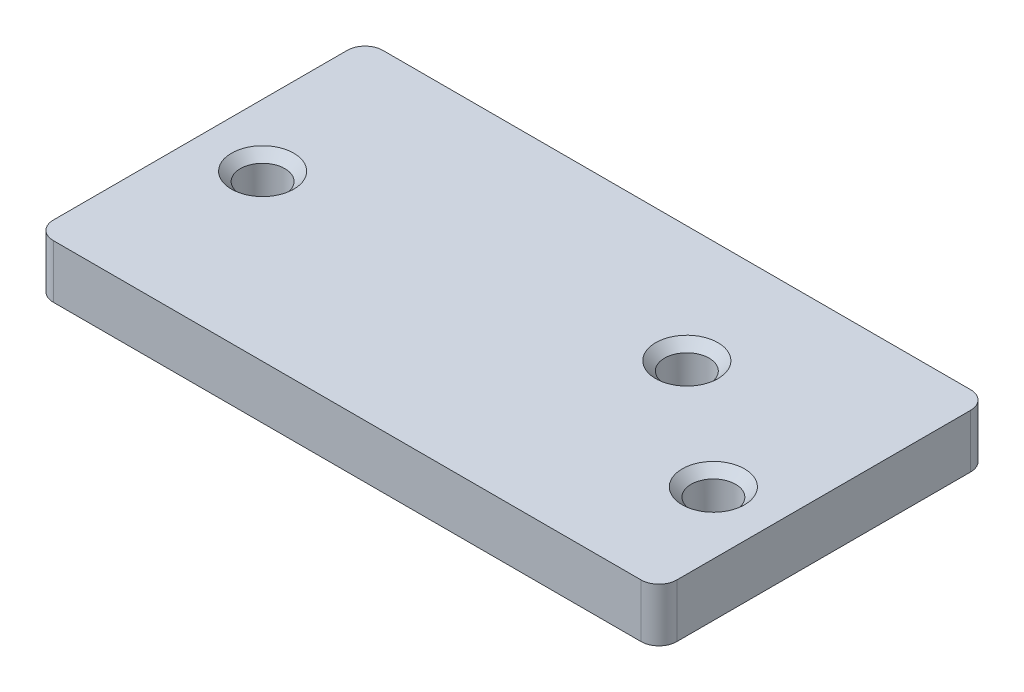
from build123d import *

# Parameters (mm, degrees)
SKETCH3_W           = 70
SKETCH3_H           = 37
BOSS_EXTRUDE1_DEPTH = 6
FILLET1_R           = 2
SKETCH4_R           = 2.5
CUT_EXTRUDE1_DEPTH  = 5
SKETCH4_3_R         = 2.5
CUT_EXTRUDE2_DEPTH  = 5
SKETCH4_5_R         = 2.5
CUT_EXTRUDE3_DEPTH  = 5
CHAMFER1_SIZE       = 1


with BuildPart() as part:
    # Sketch3 → Boss-Extrude1 (new body)
    with BuildSketch(Plane(origin=(0, 0, 0), x_dir=(1, 0, 0), z_dir=(0, 1, 0))):
        Rectangle(SKETCH3_W, SKETCH3_H)
    extrude(amount=BOSS_EXTRUDE1_DEPTH)

    # Fillet1
    fillet1_edges = [part.edges().sort_by_distance(p)[0] for p in [
        (35, 3, 18.5),
        (-35, 3, -18.5),
        (-35, 3, 18.5),
        (35, 3, -18.5),
    ]]
    fillet(fillet1_edges, radius=FILLET1_R)

    # Sketch4 → Cut-Extrude1 (cut)
    with BuildSketch(Plane(origin=(0, 6, 0), x_dir=(1, 0, 0), z_dir=(0, 1, 0))):
        with Locations((28, -5.39)):
            Circle(SKETCH4_R)
    extrude(amount=-CUT_EXTRUDE1_DEPTH, mode=Mode.SUBTRACT)

    # Sketch4<3> → Cut-Extrude2 (cut)
    with BuildSketch(Plane(origin=(0, 6, 0), x_dir=(1, 0, 0), z_dir=(0, 1, 0))):
        with Locations((14.24, 5.39)):
            Circle(SKETCH4_3_R)
    extrude(amount=-CUT_EXTRUDE2_DEPTH, mode=Mode.SUBTRACT)

    # Sketch4<5> → Cut-Extrude3 (cut)
    with BuildSketch(Plane(origin=(0, 6, 0), x_dir=(1, 0, 0), z_dir=(0, 1, 0))):
        with Locations((-28, 0)):
            Circle(SKETCH4_5_R)
    extrude(amount=-CUT_EXTRUDE3_DEPTH, mode=Mode.SUBTRACT)

    # Chamfer1
    chamfer1_edges = [part.edges().sort_by_distance(p)[0] for p in [
        (11.74, 6, -5.39),
        (-30.5, 6, 0),
        (25.5, 6, 5.39),
    ]]
    chamfer(chamfer1_edges, length=CHAMFER1_SIZE)


solid = part.part
